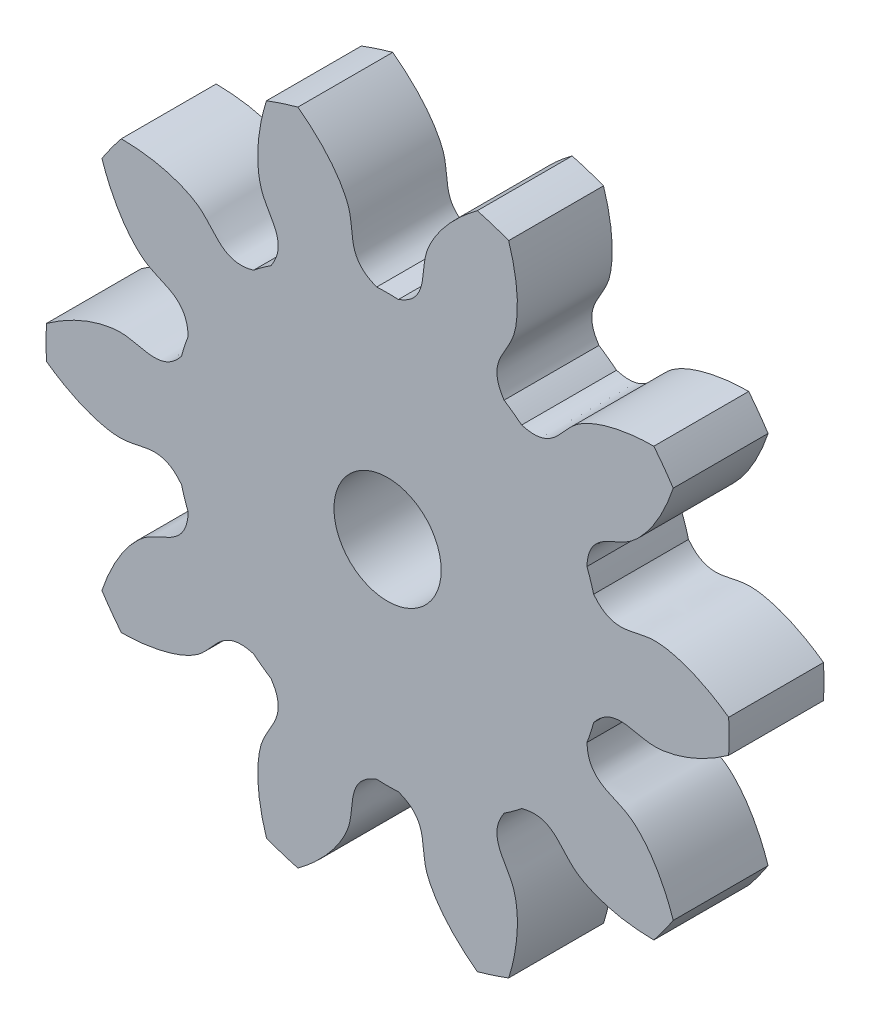
from build123d import *

# Parameters (mm, degrees)
SKETCH_1_R               = 3.6
EXTRUDE_1_DEPTH          = 1
CUT_EXTRUDE_1_DEPTH      = 6.188448708
PATTERN_CIRCULAR_1_COUNT = 10
SKETCH_4_R               = 0.565
CUT_EXTRUDE_2_DEPTH      = 6.101524929


with BuildPart() as part:
    # 草图1 → 凸台-拉伸1 (new body)
    with BuildSketch(Plane.XY):
        Circle(SKETCH_1_R)
    extrude(amount=EXTRUDE_1_DEPTH)

    # 草图2 → 切除-拉伸1 (cut, through all)
    with BuildSketch(Plane.XY):
        with BuildLine():
            ThreePointArc((0.114274959, 2.247096178), (0, 2.25), (-0.114274959, 2.247096178))
            add(Edge.make_bspline(
                [(-0.114274959, 2.247096178), (-0.435258198, 2.364340911), (-0.344304932, 2.622353667), (-0.413196964, 2.834803532), (-0.416701817, 2.84492694), (-0.420798761, 2.856036317), (-0.425527608, 2.8681118), (-0.430928741, 2.881132079), (-0.437041587, 2.895074696), (-0.44390504, 2.909915973), (-0.451557293, 2.925631058), (-0.460035845, 2.94219393), (-0.469377461, 2.959577425), (-0.479618141, 2.97775325), (-0.490793092, 2.996692005), (-0.502936694, 3.016363203), (-0.516082478, 3.036735292), (-0.530263089, 3.057775677), (-0.545510264, 3.079450741), (-0.561854801, 3.101725872), (-0.579326533, 3.124565485), (-0.597954301, 3.147933046), (-0.617765929, 3.1717911), (-0.638788198, 3.196101294), (-0.661046822, 3.220824409), (-0.684566423, 3.245920381), (-0.70937051, 3.271348335), (-0.735481454, 3.297066611), (-0.762920466, 3.32303279), (-0.791707579, 3.349203732), (-0.821861624, 3.375535599), (-0.853400212, 3.401983887), (-0.886339716, 3.428503462), (-0.92069525, 3.455048586), (-0.956480656, 3.481572955), (-0.993708481, 3.508029725), (-1.032389969, 3.534371553), (-1.07253504, 3.560550623), (-1.114152278, 3.586518686), (-1.157248919, 3.612227093), (-1.201830835, 3.637626826), (-1.247902528, 3.662668539), (-1.295467112, 3.687302588), (-1.34452631, 3.71147907), (-1.395080442, 3.73514786), (-1.447128415, 3.758258641), (-1.50066772, 3.78076095), (-1.555694421, 3.802604205), (-1.612203154, 3.82373775), (-1.67018712, 3.844110885), (-1.729638082, 3.863672909), (-1.790546362, 3.882373153), (-1.85290084, 3.900161022), (-1.916688951, 3.916986028), (-1.981896689, 3.932797827), (-2.048508604, 3.947546264), (-2.116507806, 3.961181401), (-2.185875968, 3.973653561), (-2.25659333, 3.984913363), (-2.328638696, 3.994911761), (-2.427186304, 4.006584613), (-2.501900941, 4.013152163), (-2.552151976, 4.01657334)],
                knots=[0, 0, 0, 0, 0.201720712, 0.204696754, 0.208022917, 0.211699204, 0.215725612, 0.220102144, 0.224828797, 0.229905574, 0.235332472, 0.241109493, 0.247236637, 0.253713903, 0.260541292, 0.267718803, 0.275246437, 0.283124193, 0.291352071, 0.299930073, 0.308858196, 0.318136442, 0.327764811, 0.337743302, 0.348071916, 0.358750652, 0.36977951, 0.381158491, 0.392887595, 0.404966821, 0.41739617, 0.430175641, 0.443305234, 0.45678495, 0.470614789, 0.48479475, 0.499324833, 0.514205039, 0.529435368, 0.545015819, 0.560946392, 0.577227088, 0.593857907, 0.610838848, 0.628169911, 0.645851097, 0.663882406, 0.682263837, 0.70099539, 0.720077066, 0.739508864, 0.759290785, 0.779422829, 0.799904995, 0.820737283, 0.841919694, 0.863452227, 0.885334883, 0.907567662, 0.930150562, 0.953083586, 1, 1, 1, 1], degree=3))
            ThreePointArc((-2.552151976, 4.01657334), (0, 4.758817196), (2.552151976, 4.01657334))
            add(Edge.make_bspline(
                [(0.114274959, 2.247096178), (0.435258198, 2.364340911), (0.344304932, 2.622353667), (0.413196964, 2.834803532), (0.416701817, 2.84492694), (0.420798761, 2.856036317), (0.425527608, 2.8681118), (0.430928741, 2.881132079), (0.437041587, 2.895074696), (0.44390504, 2.909915973), (0.451557293, 2.925631058), (0.460035845, 2.94219393), (0.469377461, 2.959577425), (0.479618141, 2.97775325), (0.490793092, 2.996692005), (0.502936694, 3.016363203), (0.516082478, 3.036735292), (0.530263089, 3.057775677), (0.545510264, 3.079450741), (0.561854801, 3.101725872), (0.579326533, 3.124565485), (0.597954301, 3.147933046), (0.617765929, 3.1717911), (0.638788198, 3.196101294), (0.661046822, 3.220824409), (0.684566423, 3.245920381), (0.70937051, 3.271348335), (0.735481454, 3.297066611), (0.762920466, 3.32303279), (0.791707579, 3.349203732), (0.821861624, 3.375535599), (0.853400212, 3.401983887), (0.886339716, 3.428503462), (0.92069525, 3.455048586), (0.956480656, 3.481572955), (0.993708481, 3.508029725), (1.032389969, 3.534371553), (1.07253504, 3.560550623), (1.114152278, 3.586518686), (1.157248919, 3.612227093), (1.201830835, 3.637626826), (1.247902528, 3.662668539), (1.295467112, 3.687302588), (1.34452631, 3.71147907), (1.395080442, 3.73514786), (1.447128415, 3.758258641), (1.50066772, 3.78076095), (1.555694421, 3.802604205), (1.612203154, 3.82373775), (1.67018712, 3.844110885), (1.729638082, 3.863672909), (1.790546362, 3.882373153), (1.85290084, 3.900161022), (1.916688951, 3.916986028), (1.981896689, 3.932797827), (2.048508604, 3.947546264), (2.116507806, 3.961181401), (2.185875968, 3.973653561), (2.25659333, 3.984913363), (2.328638696, 3.994911761), (2.427186304, 4.006584613), (2.501900941, 4.013152163), (2.552151976, 4.01657334)],
                knots=[0, 0, 0, 0, 0.201720712, 0.204696754, 0.208022917, 0.211699204, 0.215725612, 0.220102144, 0.224828797, 0.229905574, 0.235332472, 0.241109493, 0.247236637, 0.253713903, 0.260541292, 0.267718803, 0.275246437, 0.283124193, 0.291352071, 0.299930073, 0.308858196, 0.318136442, 0.327764811, 0.337743302, 0.348071916, 0.358750652, 0.36977951, 0.381158491, 0.392887595, 0.404966821, 0.41739617, 0.430175641, 0.443305234, 0.45678495, 0.470614789, 0.48479475, 0.499324833, 0.514205039, 0.529435368, 0.545015819, 0.560946392, 0.577227088, 0.593857907, 0.610838848, 0.628169911, 0.645851097, 0.663882406, 0.682263837, 0.70099539, 0.720077066, 0.739508864, 0.759290785, 0.779422829, 0.799904995, 0.820737283, 0.841919694, 0.863452227, 0.885334883, 0.907567662, 0.930150562, 0.953083586, 1, 1, 1, 1], degree=3))
        make_face()
    cut_extrude_1 = extrude(amount=CUT_EXTRUDE_1_DEPTH, mode=Mode.SUBTRACT)

    # 阵列(圆周)1: 切除-拉伸1 ×10 about axis
    pattern_circular_1_axis = Axis((0, 0, -1.5), (0, 0, 1))
    for i in range(1, PATTERN_CIRCULAR_1_COUNT):
        add(cut_extrude_1.rotate(pattern_circular_1_axis, i * 360 / PATTERN_CIRCULAR_1_COUNT), mode=Mode.SUBTRACT)

    # 草图4 → 切除-拉伸2 (cut, through all)
    with BuildSketch(Plane.XY.offset(1)):
        Circle(SKETCH_4_R)
    extrude(amount=-CUT_EXTRUDE_2_DEPTH, mode=Mode.SUBTRACT)


solid = part.part
